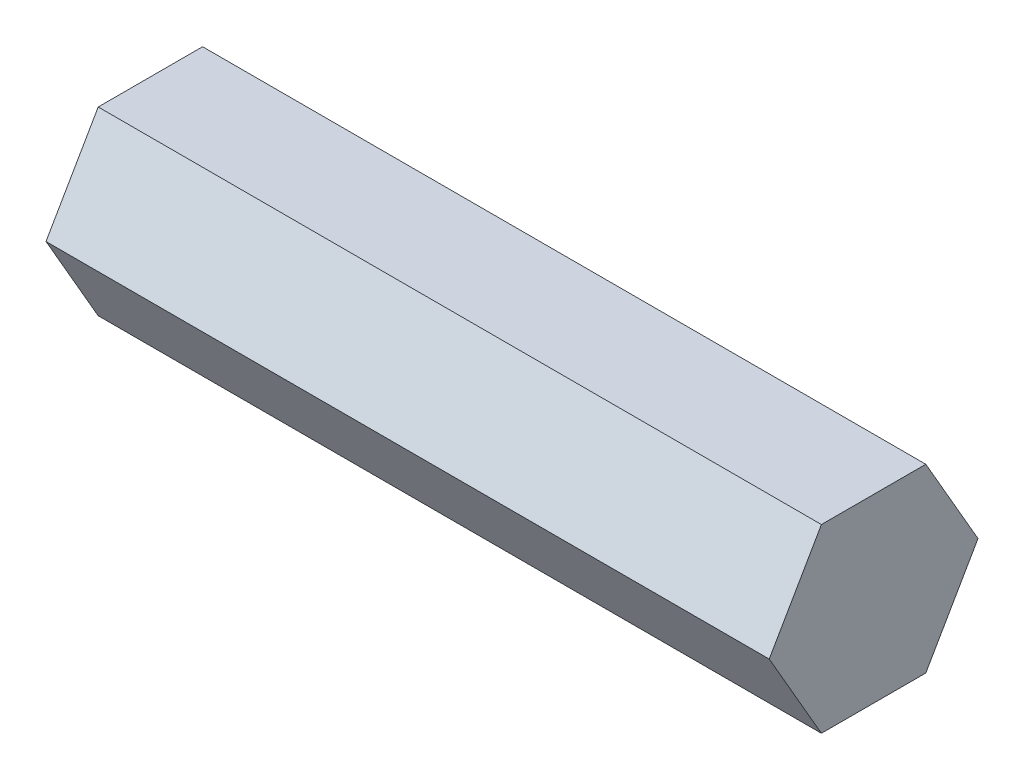
from build123d import *

# Parameters (mm, degrees)
BOSS_EXTRUDE1_DEPTH = 50.8


with BuildPart() as part:
    # Sketch1 → Boss-Extrude1 (new body)
    with BuildSketch(Plane(origin=(0, 0, 0), x_dir=(0, 0, -1), z_dir=(1, 0, 0))):
        Polygon((7.332348419, 0), (3.666174209, 6.35), (-3.666174209, 6.35), (-7.332348419, 0), (-3.666174209, -6.35), (3.666174209, -6.35), align=None)
    extrude(amount=BOSS_EXTRUDE1_DEPTH)


solid = part.part
